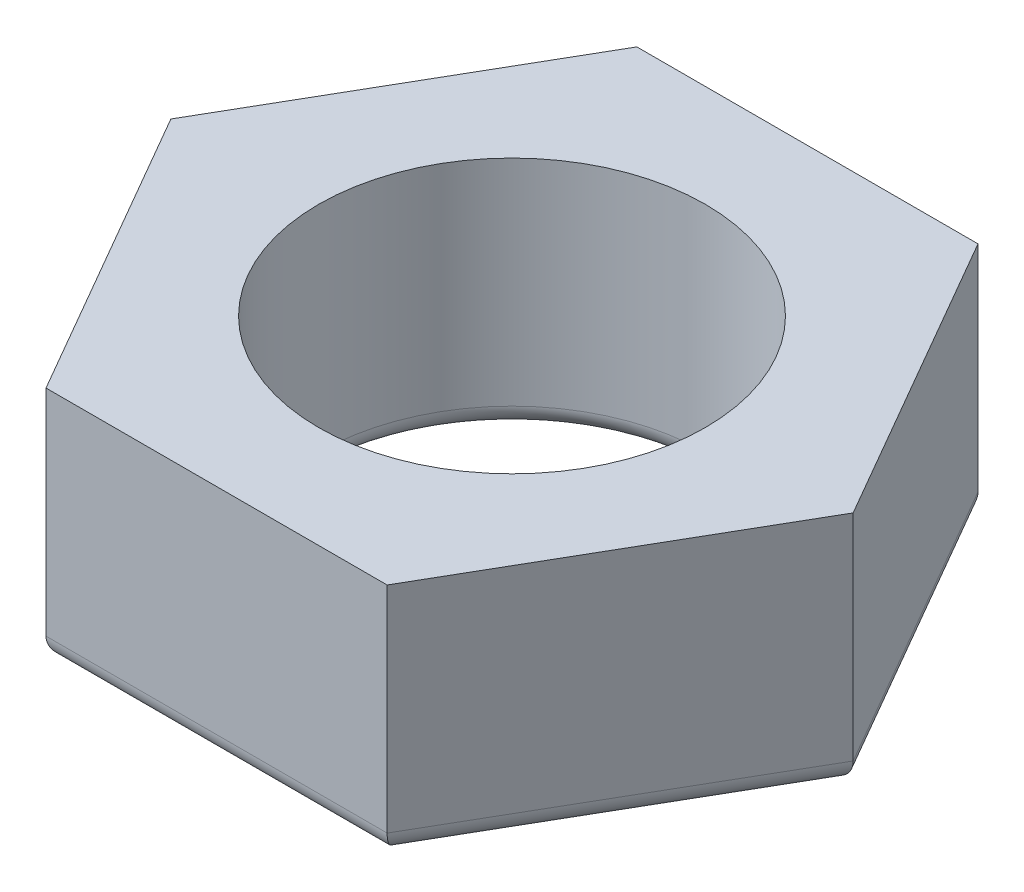
from build123d import *

# Parameters (mm, degrees)
BOSS_EXTRU_1_DEPTH   = 2.2
D_GAGEMENT_M31_D     = 3.6
D_GAGEMENT_M31_DEPTH = 2.2
D_GAGEMENT_M31_TIP   = 1.081549114
CONG_1_R             = 0.2


with BuildPart() as part:
    # Esquisse1 → Boss.-Extru.1 (new body)
    with BuildSketch(Plane(origin=(0, 0, 0), x_dir=(1, 0, 0), z_dir=(0, 1, 0))):
        Polygon((1.58771324, 2.75), (-1.58771324, 2.75), (-3.175426481, 0), (-1.58771324, -2.75), (1.58771324, -2.75), (3.175426481, 0), align=None)
    extrude(amount=BOSS_EXTRU_1_DEPTH)

    # Dégagement M31
    with Locations(Plane(origin=(0, 2.2, 0), x_dir=(1, 0, 0), z_dir=(0, 1, 0))):
        with Locations((0, 0)):
            Hole(D_GAGEMENT_M31_D / 2, depth=D_GAGEMENT_M31_DEPTH)
            with Locations((0, 0, -(D_GAGEMENT_M31_DEPTH + D_GAGEMENT_M31_TIP / 2))):  # 118° drill point
                Cone(0, D_GAGEMENT_M31_D / 2, D_GAGEMENT_M31_TIP, mode=Mode.SUBTRACT)

    # Congé1
    cong_1_edges = [part.edges().sort_by_distance(p)[0] for p in [
        (1.8, 0, 0),
        (2.38156986, 0, 1.375),
        (0, 0, 2.75),
        (-2.38156986, 0, 1.375),
        (-2.38156986, 0, -1.375),
        (0, 0, -2.75),
        (2.38156986, 0, -1.375),
    ]]
    fillet(cong_1_edges, radius=CONG_1_R)


solid = part.part
